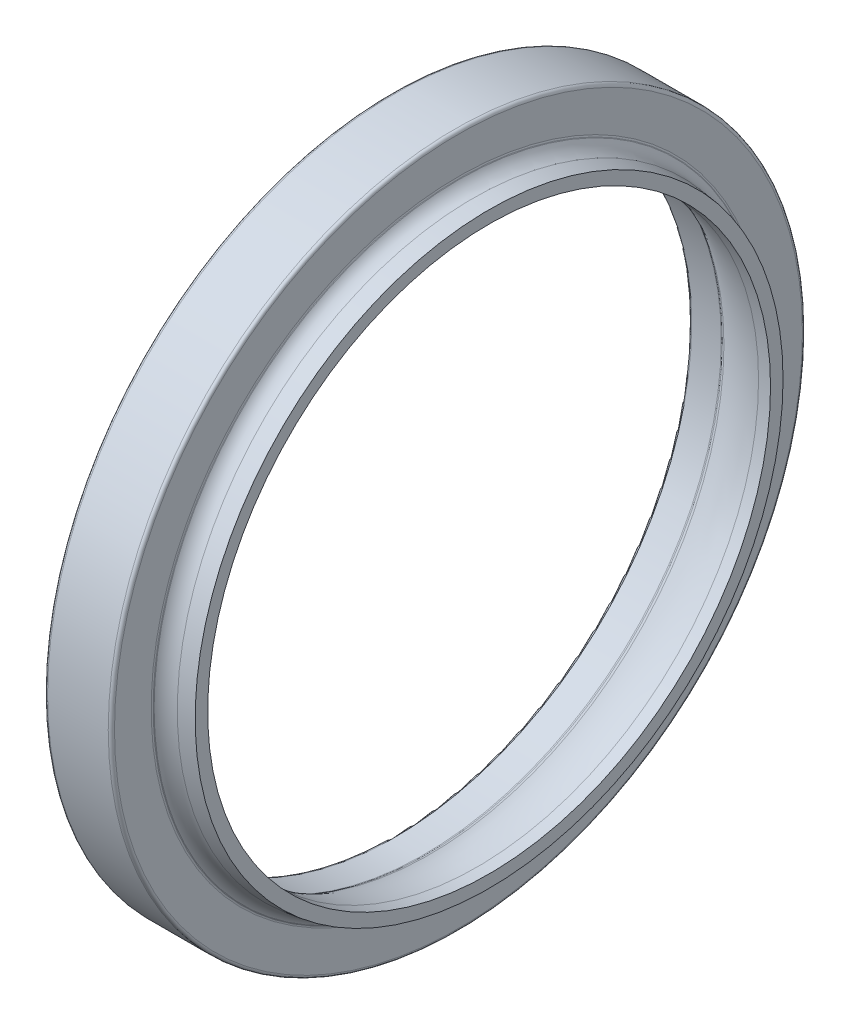
from build123d import *


with BuildPart() as part:
    # Sketch1 → Revolve1 (revolve)
    with BuildSketch(Plane(origin=(0, 0, 0), x_dir=(1, 0, 0), z_dir=(0, 1, 0))):
        with BuildLine():
            Line((7.8, 23.5), (7.8, 22.5))
            Line((7.8, 22.5), (6.842312192, 22.5))
            ThreePointArc((6.842312192, 22.5), (4.871753846, 22.763502242), (3.039661243, 23.535493386))
            Line((3.039661243, 23.535493386), (2.733677959, 23.715483554))
            ThreePointArc((2.733677959, 23.715483554), (2.672608205, 23.741216592), (2.606922927, 23.75))
            Line((2.606922927, 23.75), (0.25, 23.75))
            ThreePointArc((0.25, 23.75), (0.073223305, 23.823223305), (0, 24))
            Line((0, 24), (0, 27.5))
            ThreePointArc((0, 27.5), (0.073223305, 27.676776695), (0.25, 27.75))
            Line((0.25, 27.75), (5.1, 27.75))
            ThreePointArc((5.1, 27.75), (5.276776695, 27.676776695), (5.35, 27.5))
            Line((5.35, 27.5), (5.35, 24.566987298))
            ThreePointArc((5.35, 24.566987298), (5.358518543, 24.502282537), (5.383493649, 24.441987298))
            Line((5.383493649, 24.441987298), (5.410533744, 24.39515248))
            ThreePointArc((5.410533744, 24.39515248), (5.881666372, 23.894323747), (6.526767835, 23.656333252))
            Line((6.526767835, 23.656333252), (7.8, 23.5))
        make_face()
    revolve(axis=Axis((88.99, 0, 0), (-1, 0, 0)))


solid = part.part
